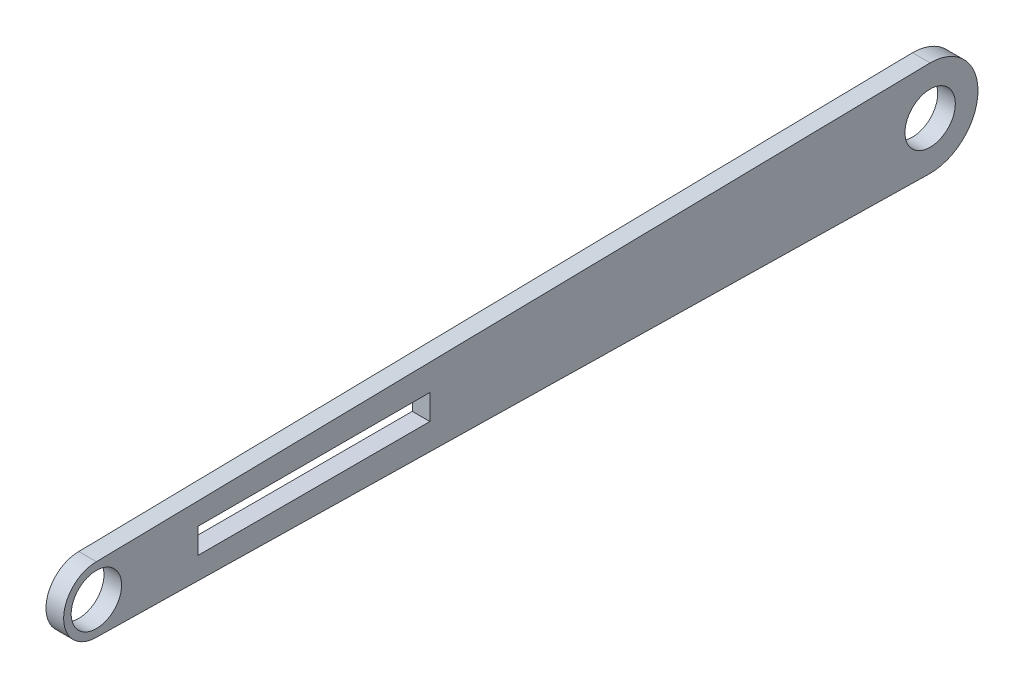
from build123d import *

# Parameters (mm, degrees)
SKETCH1_R           = 0.5
SKETCH1_W           = 4.6
SKETCH1_H           = 0.5
BOSS_EXTRUDE1_DEPTH = 0.35


with BuildPart() as part:
    # Sketch1 → Boss-Extrude1 (new body)
    with BuildSketch(Plane(origin=(0, 0, 0), x_dir=(0, 0, -1), z_dir=(1, 0, 0))):
        with BuildLine():
            Line((16.515570225, 0.949375895), (0, 0.65))
            ThreePointArc((0, 0.65), (-0.65, 0), (0, -0.65))
            Line((0, -0.65), (16.515570225, -0.949375895))
            Line((16.515570225, -0.949375895), (16.55, -0.95))
            ThreePointArc((16.55, -0.95), (17.5, 0), (16.55, 0.95))
            Line((16.55, 0.95), (16.515570225, 0.949375895))
        make_face()
        Circle(SKETCH1_R, mode=Mode.SUBTRACT)
        with Locations((4.32, 0)):
            Rectangle(SKETCH1_W, SKETCH1_H, mode=Mode.SUBTRACT)
        with Locations((16.55, 0)):
            Circle(SKETCH1_R, mode=Mode.SUBTRACT)
    extrude(amount=BOSS_EXTRUDE1_DEPTH)


solid = part.part
